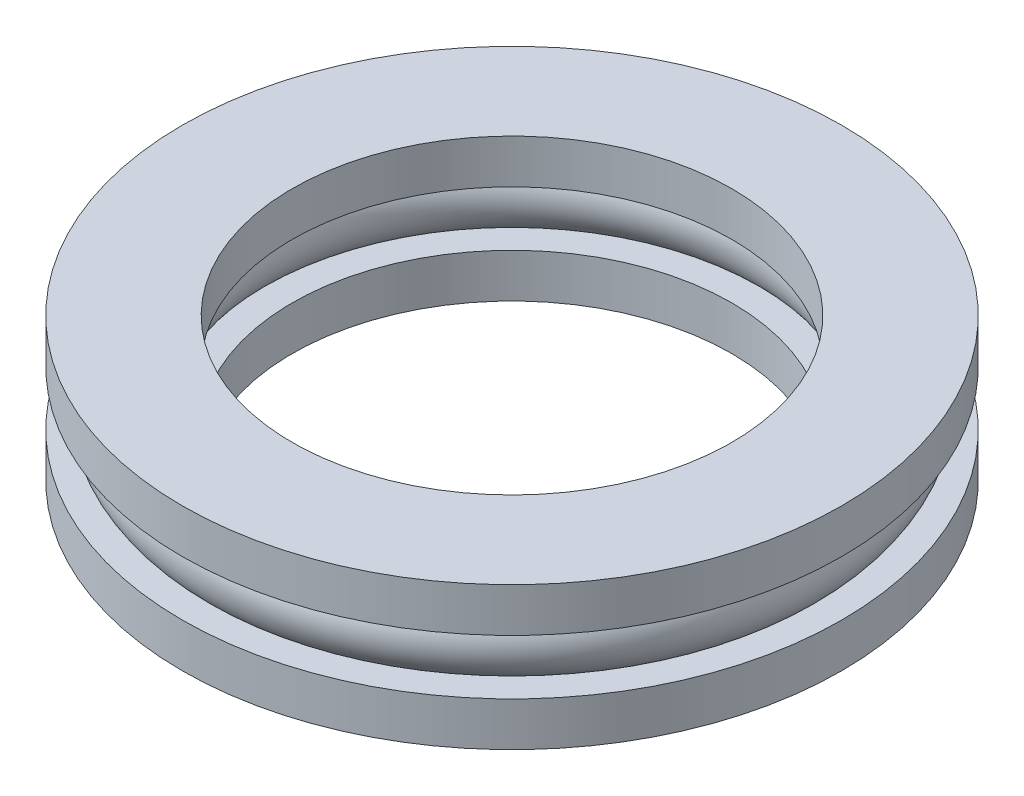
from build123d import *
from build123d.topology import SkipClean


with BuildPart() as part:
    # Sketch1 → Revolve1 (revolve)
    with SkipClean():  # the faces are left unmerged after this step: merging them gives an invalid solid
        with BuildSketch(Plane.XY, mode=Mode.PRIVATE) as revolve1_sk:
            with BuildLine():
                Line((20, 6.5), (20, 2.5))
                Line((20, 2.5), (22.550510257, 2.5))
                ThreePointArc((22.550510257, 2.5), (25, 3.5), (27.449489743, 2.5))
                Line((27.449489743, 2.5), (30, 2.5))
                Line((30, 2.5), (30, 6.5))
                Line((30, 6.5), (20, 6.5))
            make_face()
            with BuildLine():
                Line((27.449489743, 2.5), (22.550510257, 2.5))
                ThreePointArc((22.550510257, 2.5), (21.5, 0), (22.550510257, -2.5))
                Line((22.550510257, -2.5), (27.449489743, -2.5))
                ThreePointArc((27.449489743, -2.5), (28.226702194, -1.355873501), (28.5, 0))
                ThreePointArc((28.5, 0), (28.226702194, 1.355873501), (27.449489743, 2.5))
            make_face()
            with BuildLine():
                ThreePointArc((27.449489743, 2.5), (25, 3.5), (22.550510257, 2.5))
                Line((22.550510257, 2.5), (27.449489743, 2.5))
            make_face()
            with BuildLine():
                Line((27.449489743, -2.5), (22.550510257, -2.5))
                ThreePointArc((22.550510257, -2.5), (25, -3.5), (27.449489743, -2.5))
            make_face()
            with BuildLine():
                Line((22.550510257, -2.5), (20, -2.5))
                Line((20, -2.5), (20, -6.5))
                Line((20, -6.5), (30, -6.5))
                Line((30, -6.5), (30, -2.5))
                Line((30, -2.5), (27.449489743, -2.5))
                ThreePointArc((27.449489743, -2.5), (25, -3.5), (22.550510257, -2.5))
            make_face()
        revolve(revolve1_sk.sketch.rotate(Axis((0, 0, 0), (0, 1, 0)), 90), axis=Axis((0, 0, 0), (0, 1, 0)))


solid = part.part
